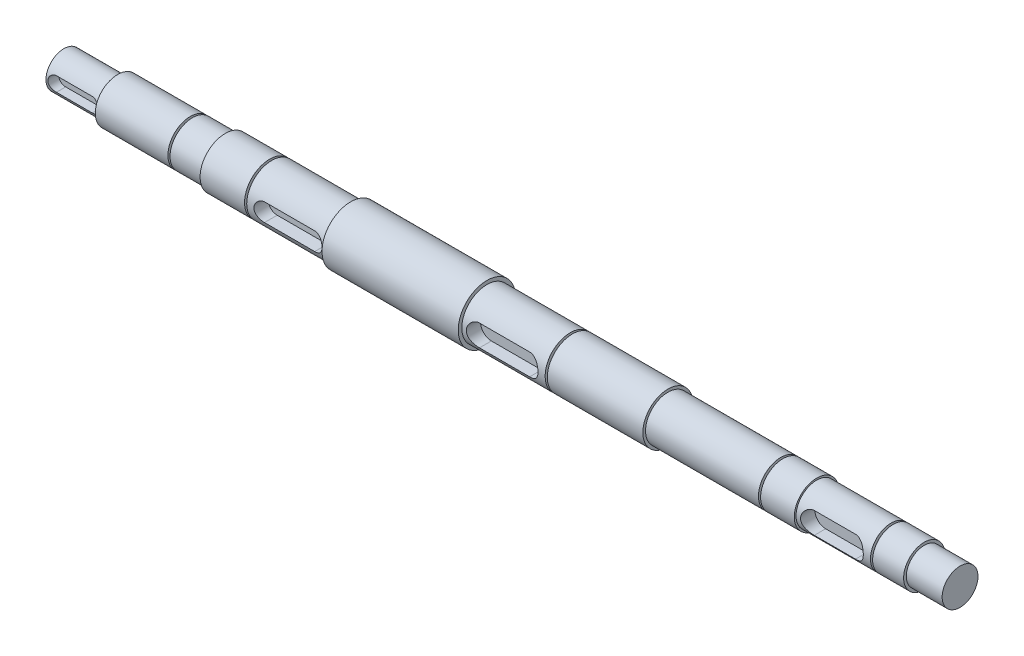
from build123d import *

# Parameters (mm, degrees)
SKETCH1_R            = 10
BOSS_EXTRUDE1_DEPTH  = 30
SKETCH2_R            = 12.5
BOSS_EXTRUDE5_DEPTH  = 60
SKETCH5_R            = 14
BOSS_EXTRUDE8_DEPTH  = 70
SKETCH7_R            = 16
BOSS_EXTRUDE9_DEPTH  = 76
SKETCH8_R            = 14
BOSS_EXTRUDE13_DEPTH = 24
SKETCH12_R           = 12.5
BOSS_EXTRUDE15_DEPTH = 150
SKETCH14_R           = 11.5
BOSS_EXTRUDE16_DEPTH = 70
SKETCH15_R           = 10
BOSS_EXTRUDE17_DEPTH = 20
CUT_EXTRUDE1_DEPTH   = 6
CUT_EXTRUDE2_DEPTH   = 8
SKETCH18_R           = 14
CUT_EXTRUDE3_DEPTH   = 264
SKETCH19_R           = 14
BOSS_EXTRUDE18_DEPTH = 45
SKETCH20_R           = 12.5
BOSS_EXTRUDE19_DEPTH = 139
SKETCH21_R           = 11.5
BOSS_EXTRUDE20_DEPTH = 60
SKETCH22_R           = 10
BOSS_EXTRUDE21_DEPTH = 20
CUT_EXTRUDE4_DEPTH   = 8
CUT_EXTRUDE5_DEPTH   = 8
SKETCH26_W           = 1.2
SKETCH26_H           = 1.8
SKETCH30_W           = 1.2
SKETCH30_H           = 1.8
SKETCH31_W           = 1.2
SKETCH31_H           = 1.8
SKETCH34_W           = 1.2
SKETCH34_H           = 1.8
SKETCH35_R           = 14
BOSS_EXTRUDE22_DEPTH = 56
SKETCH36_W           = 1.2
SKETCH36_H           = 1.8


with BuildPart() as part:
    # Sketch1 → Boss-Extrude1 (new body)
    with BuildSketch(Plane(origin=(0, 0, 0), x_dir=(0, 0, -1), z_dir=(1, 0, 0))):
        Circle(SKETCH1_R)
    extrude(amount=BOSS_EXTRUDE1_DEPTH)

    # Sketch2 → Boss-Extrude5 (add)
    with BuildSketch(Plane(origin=(30, 0, 0), x_dir=(0, 0, -1), z_dir=(1, 0, 0))):
        Circle(SKETCH2_R)
    extrude(amount=BOSS_EXTRUDE5_DEPTH)

    # Sketch5 → Boss-Extrude8 (add)
    with BuildSketch(Plane(origin=(90, 0, 0), x_dir=(0, 0, -1), z_dir=(1, 0, 0))):
        Circle(SKETCH5_R)
    extrude(amount=BOSS_EXTRUDE8_DEPTH)

    # Sketch7 → Boss-Extrude9 (add)
    with BuildSketch(Plane(origin=(160, 0, 0), x_dir=(0, 0, -1), z_dir=(1, 0, 0))):
        Circle(SKETCH7_R)
    extrude(amount=BOSS_EXTRUDE9_DEPTH)

    # Sketch8 → Boss-Extrude13 (add)
    with BuildSketch(Plane(origin=(236, 0, 0), x_dir=(0, 0, -1), z_dir=(1, 0, 0))):
        Circle(SKETCH8_R)
    extrude(amount=BOSS_EXTRUDE13_DEPTH)

    # Sketch12 → Boss-Extrude15 (add)
    with BuildSketch(Plane(origin=(260, 0, 0), x_dir=(0, 0, -1), z_dir=(1, 0, 0))):
        Circle(SKETCH12_R)
    extrude(amount=BOSS_EXTRUDE15_DEPTH)

    # Sketch14 → Boss-Extrude16 (add)
    with BuildSketch(Plane(origin=(410, 0, 0), x_dir=(0, 0, -1), z_dir=(1, 0, 0))):
        Circle(SKETCH14_R)
    extrude(amount=BOSS_EXTRUDE16_DEPTH)

    # Sketch15 → Boss-Extrude17 (add)
    with BuildSketch(Plane(origin=(480, 0, 0), x_dir=(0, 0, -1), z_dir=(1, 0, 0))):
        Circle(SKETCH15_R)
    extrude(amount=BOSS_EXTRUDE17_DEPTH)

    # Sketch16 → Cut-Extrude1 (cut)
    with BuildSketch(Plane.XY.offset(10)):
        with BuildLine():
            Line((5, 4), (25, 4))
            ThreePointArc((25, 4), (29, 0), (25, -4))
            Line((25, -4), (5, -4))
            ThreePointArc((5, -4), (1, 0), (5, 4))
        make_face()
    extrude(amount=-CUT_EXTRUDE1_DEPTH, mode=Mode.SUBTRACT)

    # Sketch17 → Cut-Extrude2 (cut)
    with BuildSketch(Plane.XY.offset(14)):
        with BuildLine():
            Line((125, 5), (153, 5))
            ThreePointArc((153, 5), (158, 0), (153, -5))
            Line((153, -5), (125, -5))
            ThreePointArc((125, -5), (120, 0), (125, 5))
        make_face()
    extrude(amount=-CUT_EXTRUDE2_DEPTH, mode=Mode.SUBTRACT)

    # Sketch18 → Cut-Extrude3 (cut)
    with BuildSketch(Plane(origin=(236, 0, 0), x_dir=(0, 0, -1), z_dir=(1, 0, 0))):
        Circle(SKETCH18_R)
    extrude(amount=CUT_EXTRUDE3_DEPTH, mode=Mode.SUBTRACT)

    # Sketch19 → Boss-Extrude18 (add)
    with BuildSketch(Plane(origin=(236, 0, 0), x_dir=(0, 0, -1), z_dir=(1, 0, 0))):
        Circle(SKETCH19_R)
    extrude(amount=BOSS_EXTRUDE18_DEPTH)

    # Sketch20 → Boss-Extrude19 (add)
    with BuildSketch(Plane(origin=(281, 0, 0), x_dir=(0, 0, -1), z_dir=(1, 0, 0))):
        Circle(SKETCH20_R)
    extrude(amount=BOSS_EXTRUDE19_DEPTH)

    # Sketch21 → Boss-Extrude20 (add)
    with BuildSketch(Plane(origin=(420, 0, 0), x_dir=(0, 0, -1), z_dir=(1, 0, 0))):
        Circle(SKETCH21_R)
    extrude(amount=BOSS_EXTRUDE20_DEPTH)

    # Sketch22 → Boss-Extrude21 (add)
    with BuildSketch(Plane(origin=(480, 0, 0), x_dir=(0, 0, -1), z_dir=(1, 0, 0))):
        Circle(SKETCH22_R)
    extrude(amount=BOSS_EXTRUDE21_DEPTH)

    # Sketch24 → Cut-Extrude4 (cut)
    with BuildSketch(Plane.XY.offset(14)):
        with BuildLine():
            Line((244.5, 6), (272.5, 6))
            ThreePointArc((272.5, 6), (278.5, 0), (272.5, -6))
            Line((272.5, -6), (244.5, -6))
            ThreePointArc((244.5, -6), (238.5, 0), (244.5, 6))
        make_face()
    extrude(amount=-CUT_EXTRUDE4_DEPTH, mode=Mode.SUBTRACT)

    # Sketch25 → Cut-Extrude5 (cut)
    with BuildSketch(Plane.XY.offset(11.5)):
        with BuildLine():
            Line((428.5, 6), (451.5, 6))
            ThreePointArc((451.5, 6), (457.5, 0), (451.5, -6))
            Line((451.5, -6), (428.5, -6))
            ThreePointArc((428.5, -6), (422.5, 0), (428.5, 6))
        make_face()
    extrude(amount=-CUT_EXTRUDE5_DEPTH, mode=Mode.SUBTRACT)

    # Sketch26 → Cut-Revolve2 (revolve, cut)
    with BuildSketch(Plane(origin=(0, 0, 0), x_dir=(1, 0, 0), z_dir=(0, 1, 0))):
        with Locations((71.13362974, -11.6)):
            Rectangle(SKETCH26_W, SKETCH26_H)
    revolve(axis=Axis((30.471957332, 0, 0), (1, 0, 0)), mode=Mode.SUBTRACT)

    # Sketch30 → Cut-Revolve5 (revolve, cut)
    with BuildSketch(Plane(origin=(0, 0, 0), x_dir=(1, 0, 0), z_dir=(0, 1, 0))):
        with Locations((462.1, -10.6)):
            Rectangle(SKETCH30_W, SKETCH30_H)
    revolve(axis=Axis((419.735953091, 0, 0), (1, 0, 0)), mode=Mode.SUBTRACT)

    # Sketch31 → Cut-Revolve6 (revolve, cut)
    with BuildSketch(Plane(origin=(0, 0, 0), x_dir=(1, 0, 0), z_dir=(0, 1, 0))):
        with Locations((400.6, -11.6)):
            Rectangle(SKETCH31_W, SKETCH31_H)
    revolve(axis=Axis((419.735953091, 0, 0), (-1, 0, 0)), mode=Mode.SUBTRACT)

    # Sketch34 → Cut-Revolve8 (revolve, cut)
    with BuildSketch(Plane(origin=(0, 0, 0), x_dir=(1, 0, 0), z_dir=(0, 1, 0))):
        with Locations((115.4, -13.1)):
            Rectangle(SKETCH34_W, SKETCH34_H)
    revolve(axis=Axis((91.001068782, 0, 0), (1, 0, 0)), mode=Mode.SUBTRACT)

    # Sketch35 → Boss-Extrude22 (add)
    with BuildSketch(Plane(origin=(281, 0, 0), x_dir=(0, 0, -1), z_dir=(1, 0, 0))):
        with Locations(Location((0, 0, 0), (0, 0, 180))):
            Circle(SKETCH35_R)
    extrude(amount=BOSS_EXTRUDE22_DEPTH)

    # Sketch36 → Cut-Revolve9 (revolve, cut)
    with BuildSketch(Plane(origin=(0, 0, 0), x_dir=(1, 0, 0), z_dir=(0, 1, 0))):
        with Locations((283.1, -13.1)):
            Rectangle(SKETCH36_W, SKETCH36_H)
    revolve(axis=Axis((235.166197804, 0, 0), (1, 0, 0)), mode=Mode.SUBTRACT)


solid = part.part
